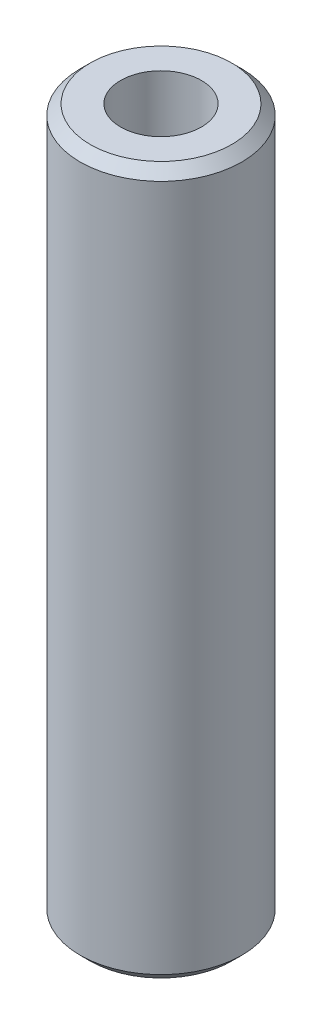
from build123d import *

# Parameters (mm, degrees)
SKETCH1_R           = 4
SKETCH1_R_2         = 2
BOSS_EXTRUDE1_DEPTH = 35
CHAMFER1_SIZE       = 0.5


with BuildPart() as part:
    # Sketch1 → Boss-Extrude1 (new body)
    with BuildSketch(Plane(origin=(0, 0, 0), x_dir=(1, 0, 0), z_dir=(0, 1, 0))):
        with Locations(Location((0, 0, 0), (0, 0, 270))):
            Circle(SKETCH1_R)
        with Locations(Location((0, 0, 0), (0, 0, 270))):
            Circle(SKETCH1_R_2, mode=Mode.SUBTRACT)
    extrude(amount=BOSS_EXTRUDE1_DEPTH)

    # Chamfer1
    chamfer1_edges = [part.edges().sort_by_distance(p)[0] for p in [
        (0, 0, -4),
        (0, 35, -4),
    ]]
    chamfer(chamfer1_edges, length=CHAMFER1_SIZE)


solid = part.part
